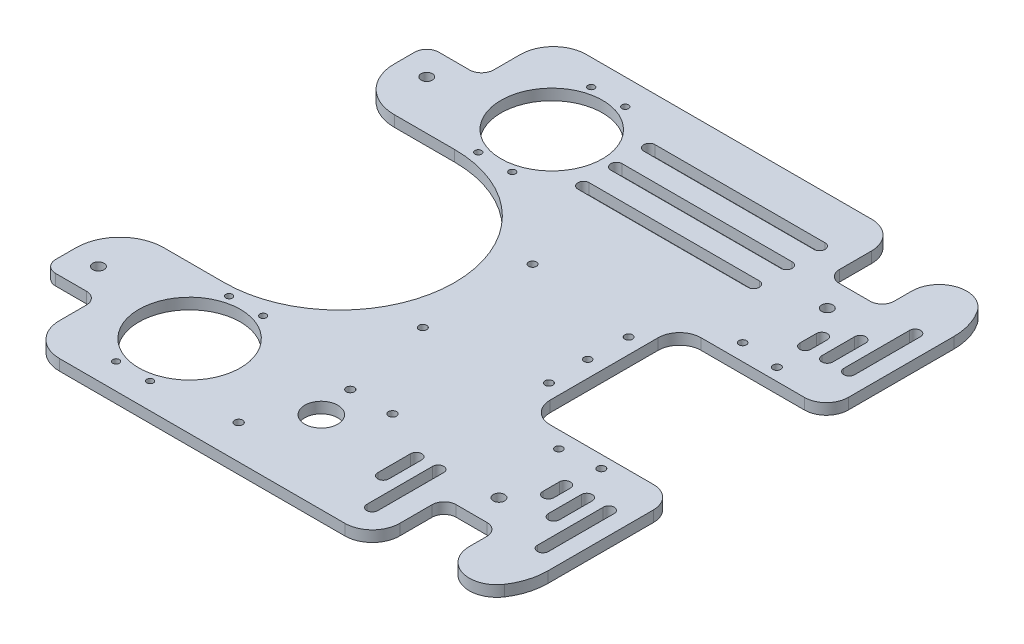
from build123d import *

# Parameters (mm, degrees)
SKETCH1_W           = 406.4
SKETCH1_H           = 304.8
BOSS_EXTRUDE1_DEPTH = 6.35
SKETCH2_R           = 29.36875
SKETCH2_R_2         = 2.2479
SKETCH2_R_3         = 1.89865
CUT_EXTRUDE1_DEPTH  = 255.079362602
FILLET1_R           = 34.925
CUT_EXTRUDE2_DEPTH  = 255.079362602
FILLET3_R           = 15.875
SKETCH7_R           = 3.2639
SKETCH7_R_2         = 2.159
CUT_EXTRUDE3_DEPTH  = 255.079362602
SKETCH8_R           = 3.2639
CUT_EXTRUDE5_DEPTH  = 255.079362602
CUT_EXTRUDE6_DEPTH  = 255.079362602
SKETCH10_W          = 44.1833
SKETCH10_H          = 6.35
BOSS_EXTRUDE2_DEPTH = 6.985
FILLET4_R           = 6.985
FILLET5_R           = 19.05
FILLET6_R           = 25.4
SKETCH12_R          = 2.2479
CUT_EXTRUDE8_DEPTH  = 255.079362602
SKETCH13_R          = 9.525
SKETCH13_R_2        = 2.325
CUT_EXTRUDE9_DEPTH  = 255.079362602
SKETCH15_W          = 49.318333333
SKETCH15_H          = 87.3125
CUT_EXTRUDE10_DEPTH = 255.079362602
FILLET7_R           = 12.7
CUT_EXTRUDE11_DEPTH = 255.079362602


with BuildPart() as part:
    # Sketch1 → Boss-Extrude1 (new body)
    with BuildSketch(Plane(origin=(0, 0, 0), x_dir=(1, 0, 0), z_dir=(0, 1, 0))):
        Rectangle(SKETCH1_W, SKETCH1_H)
    extrude(amount=BOSS_EXTRUDE1_DEPTH)

    # Sketch2 → Cut-Extrude1 (cut, through all)
    with BuildSketch(Plane.XZ):
        with Locations(Location((-16.8275, 104.775, 0), (0, 0, 270))):
            Circle(SKETCH2_R)
        with Locations(Location((167.428333333, -50.8, 0), (0, 0, 270))):
            Circle(SKETCH2_R_2)
        with Locations(Location((167.428333333, 50.8, 0), (0, 0, 270))):
            Circle(SKETCH2_R_2)
        with Locations(Location((45.085, -31.75, 0), (0, 0, 270))):
            Circle(SKETCH2_R_2)
        with Locations(Location((45.085, 31.75, 0), (0, 0, 270))):
            Circle(SKETCH2_R_2)
        with Locations(Location((-26.67, 137.4648, 0), (0, 0, 270))):
            Circle(SKETCH2_R_3)
        with Locations(Location((-6.985, 137.4648, 0), (0, 0, 270))):
            Circle(SKETCH2_R_3)
        with Locations(Location((-26.67, 72.0852, 0), (0, 0, 270))):
            Circle(SKETCH2_R_3)
        with Locations(Location((-6.985, 72.0852, 0), (0, 0, 270))):
            Circle(SKETCH2_R_3)
        with BuildLine():
            Line((170.786985294, 32.497058824), (169.990122549, 33.991176471))
            ThreePointArc((169.990122549, 33.991176471), (163.274429802, 41.054605225), (153.881666667, 43.65625))
            Line((153.881666667, 43.65625), (130.683, 43.65625))
            ThreePointArc((130.683, 43.65625), (121.904799642, 40.020200358), (118.26875, 31.242))
            Line((118.26875, 31.242), (118.26875, -31.242))
            ThreePointArc((118.26875, -31.242), (121.904799642, -40.020200358), (130.683, -43.65625))
            Line((130.683, -43.65625), (153.881666667, -43.65625))
            ThreePointArc((153.881666667, -43.65625), (163.274429802, -41.054605225), (169.990122549, -33.991176471))
            Line((169.990122549, -33.991176471), (170.786985294, -32.497058824))
            ThreePointArc((170.786985294, -32.497058824), (178.91125, 0), (170.786985294, 32.497058824))
        make_face()
        with BuildLine():
            Line((-73.025, 66.675), (-34.925, 66.675))
            ThreePointArc((-34.925, 66.675), (31.75, 0), (-34.925, -66.675))
            Line((-34.925, -66.675), (-73.025, -66.675))
            ThreePointArc((-73.025, -66.675), (-139.7, 0), (-73.025, 66.675))
        make_face()
    cut_extrude1 = extrude(amount=-CUT_EXTRUDE1_DEPTH, mode=Mode.SUBTRACT)

    # Fillet1
    fillet1_edges = [part.edges().sort_by_distance(p)[0] for p in [
        (203.2, 3.175, 152.4),
        (-203.2, 3.175, 152.4),
        (-203.2, 3.175, -152.4),
        (203.2, 3.175, -152.4),
    ]]
    fillet(fillet1_edges, radius=FILLET1_R)

    # Sketch5 → Cut-Extrude2 (cut, through all)
    with BuildSketch(Plane(origin=(0, 6.35, 0), x_dir=(1, 0, 0), z_dir=(0, 1, 0))):
        with BuildLine():
            Line((136.525, 117.8433), (136.525, 152.4))
            Line((136.525, 152.4), (168.275, 152.4))
            Line((168.275, 152.4), (168.275, 117.8433))
            ThreePointArc((168.275, 117.8433), (166.229140867, 112.904159133), (161.29, 110.8583))
            Line((161.29, 110.8583), (143.51, 110.8583))
            ThreePointArc((143.51, 110.8583), (138.570859133, 112.904159133), (136.525, 117.8433))
        make_face()
        with BuildLine():
            Line((143.51, -110.8583), (161.29, -110.8583))
            ThreePointArc((161.29, -110.8583), (166.229140867, -112.904159133), (168.275, -117.8433))
            Line((168.275, -117.8433), (168.275, -152.4))
            Line((168.275, -152.4), (136.525, -152.4))
            Line((136.525, -152.4), (136.525, -117.8433))
            ThreePointArc((136.525, -117.8433), (138.570859133, -112.904159133), (143.51, -110.8583))
        make_face()
        with BuildLine():
            Line((-95.25, 152.4), (-63.5, 152.4))
            Line((-63.5, 152.4), (-63.5, 117.8433))
            ThreePointArc((-63.5, 117.8433), (-65.545859133, 112.904159133), (-70.485, 110.8583))
            Line((-70.485, 110.8583), (-88.265, 110.8583))
            ThreePointArc((-88.265, 110.8583), (-93.204140867, 112.904159133), (-95.25, 117.8433))
            Line((-95.25, 117.8433), (-95.25, 152.4))
        make_face()
        with BuildLine():
            Line((-88.265, -110.8583), (-70.485, -110.8583))
            ThreePointArc((-70.485, -110.8583), (-65.545859133, -112.904159133), (-63.5, -117.8433))
            Line((-63.5, -117.8433), (-63.5, -152.4))
            Line((-63.5, -152.4), (-95.25, -152.4))
            Line((-95.25, -152.4), (-95.25, -117.8433))
            ThreePointArc((-95.25, -117.8433), (-93.204140867, -112.904159133), (-88.265, -110.8583))
        make_face()
    extrude(amount=-CUT_EXTRUDE2_DEPTH, mode=Mode.SUBTRACT)

    # Fillet3
    fillet3_edges = [part.edges().sort_by_distance(p)[0] for p in [
        (168.275, 3.175, 152.4),
        (168.275, 3.175, -152.4),
        (-95.25, 3.175, -152.4),
        (-95.25, 3.175, 152.4),
        (136.525, 3.175, -152.4),
        (136.525, 3.175, 152.4),
    ]]
    fillet(fillet3_edges, radius=FILLET3_R)

    # Sketch7 → Cut-Extrude3 (cut, through all)
    with BuildSketch(Plane(origin=(0, 6.35, 0), x_dir=(1, 0, 0), z_dir=(0, 1, 0))):
        with Locations(Location((152.4, 94.9833, 0), (0, 0, 270))):
            Circle(SKETCH7_R)
        with Locations(Location((152.4, -94.9833, 0), (0, 0, 270))):
            Circle(SKETCH7_R)
        with Locations(Location((145.25625, 53.18125, 0), (0, 0, 270))):
            Circle(SKETCH7_R_2)
        with Locations(Location((108.74375, 0, 0), (0, 0, 270))):
            Circle(SKETCH7_R_2)
        with Locations(Location((145.25625, -53.18125, 0), (0, 0, 270))):
            Circle(SKETCH7_R_2)
        with BuildLine():
            Line((119.0625, 127.0889), (20.6375, 127.0889))
            ThreePointArc((20.6375, 127.0889), (17.3736, 123.825), (20.6375, 120.5611))
            Line((20.6375, 120.5611), (119.0625, 120.5611))
            ThreePointArc((119.0625, 120.5611), (122.3264, 123.825), (119.0625, 127.0889))
        make_face()
        with BuildLine():
            Line((119.0625, 88.9889), (20.6375, 88.9889))
            ThreePointArc((20.6375, 88.9889), (17.3736, 85.725), (20.6375, 82.4611))
            Line((20.6375, 82.4611), (119.0625, 82.4611))
            ThreePointArc((119.0625, 82.4611), (122.3264, 85.725), (119.0625, 88.9889))
        make_face()
        with BuildLine():
            Line((119.0625, 108.0389), (20.6375, 108.0389))
            ThreePointArc((20.6375, 108.0389), (17.3736, 104.775), (20.6375, 101.5111))
            Line((20.6375, 101.5111), (119.0625, 101.5111))
            ThreePointArc((119.0625, 101.5111), (122.3264, 104.775), (119.0625, 108.0389))
        make_face()
        with BuildLine():
            Line((193.680475862, 107.6833), (193.680475862, 69.5833))
            ThreePointArc((193.680475862, 69.5833), (190.5, 66.402824138), (187.319524138, 69.5833))
            Line((187.319524138, 69.5833), (187.319524138, 107.6833))
            ThreePointArc((187.319524138, 107.6833), (190.5, 110.863775862), (193.680475862, 107.6833))
        make_face()
        with BuildLine():
            Line((174.619524138, 69.5833), (174.619524138, 88.6333))
            ThreePointArc((174.619524138, 88.6333), (177.8, 91.813775862), (180.980475862, 88.6333))
            Line((180.980475862, 88.6333), (180.980475862, 69.5833))
            ThreePointArc((180.980475862, 69.5833), (177.8, 66.402824138), (174.619524138, 69.5833))
        make_face()
        with BuildLine():
            Line((168.280475862, 79.1083), (168.280475862, 69.5833))
            ThreePointArc((168.280475862, 69.5833), (165.1, 66.402824138), (161.919524138, 69.5833))
            Line((161.919524138, 69.5833), (161.919524138, 79.1083))
            ThreePointArc((161.919524138, 79.1083), (165.1, 82.288775862), (168.280475862, 79.1083))
        make_face()
        with BuildLine():
            Line((193.680475862, -107.6833), (193.680475862, -69.5833))
            ThreePointArc((193.680475862, -69.5833), (190.5, -66.402824138), (187.319524138, -69.5833))
            Line((187.319524138, -69.5833), (187.319524138, -107.6833))
            ThreePointArc((187.319524138, -107.6833), (190.5, -110.863775862), (193.680475862, -107.6833))
        make_face()
        with BuildLine():
            Line((174.619524138, -69.5833), (174.619524138, -88.6333))
            ThreePointArc((174.619524138, -88.6333), (177.8, -91.813775862), (180.980475862, -88.6333))
            Line((180.980475862, -88.6333), (180.980475862, -69.5833))
            ThreePointArc((180.980475862, -69.5833), (177.8, -66.402824138), (174.619524138, -69.5833))
        make_face()
        with BuildLine():
            Line((168.280475862, -79.1083), (168.280475862, -69.5833))
            ThreePointArc((168.280475862, -69.5833), (165.1, -66.402824138), (161.919524138, -69.5833))
            Line((161.919524138, -69.5833), (161.919524138, -79.1083))
            ThreePointArc((161.919524138, -79.1083), (165.1, -82.288775862), (168.280475862, -79.1083))
        make_face()
    extrude(amount=-CUT_EXTRUDE3_DEPTH, mode=Mode.SUBTRACT)

    # Sketch8 → Cut-Extrude5 (cut, through all)
    with BuildSketch(Plane(origin=(0, 6.35, 0), x_dir=(1, 0, 0), z_dir=(0, 1, 0))):
        with Locations(Location((-79.375, 94.9833, 0), (0, 0, 270))):
            Circle(SKETCH8_R)
        with Locations(Location((-79.375, -94.9833, 0), (0, 0, 90))):
            Circle(SKETCH8_R)
        with BuildLine():
            Line((-95.25, 136.525), (-95.25, 117.8433))
            ThreePointArc((-95.25, 117.8433), (-93.204140867, 112.904159133), (-88.265, 110.8583))
            ThreePointArc((-88.265, 110.8583), (-110.35665, 88.76665), (-88.265, 66.675))
            Line((-88.265, 66.675), (-73.025, 66.675))
            ThreePointArc((-73.025, 66.675), (-139.7, 0), (-73.025, -66.675))
            Line((-73.025, -66.675), (-88.265, -66.675))
            ThreePointArc((-88.265, -66.675), (-110.35665, -88.76665), (-88.265, -110.8583))
            ThreePointArc((-88.265, -110.8583), (-93.204140867, -112.904159133), (-95.25, -117.8433))
            Line((-95.25, -117.8433), (-95.25, -136.525))
            ThreePointArc((-95.25, -136.525), (-99.899679849, -147.750320151), (-111.125, -152.4))
            Line((-111.125, -152.4), (-168.275, -152.4))
            ThreePointArc((-168.275, -152.4), (-192.970704333, -142.170704333), (-203.2, -117.475))
            Line((-203.2, -117.475), (-203.2, 117.475))
            ThreePointArc((-203.2, 117.475), (-192.970704333, 142.170704333), (-168.275, 152.4))
            Line((-168.275, 152.4), (-111.125, 152.4))
            ThreePointArc((-111.125, 152.4), (-99.899679849, 147.750320151), (-95.25, 136.525))
        make_face()
    extrude(amount=-CUT_EXTRUDE5_DEPTH, mode=Mode.SUBTRACT)

    # Sketch9 → Cut-Extrude6 (cut, through all)
    with BuildSketch(Plane(origin=(0, 6.35, 0), x_dir=(1, 0, 0), z_dir=(0, 1, 0))):
        with BuildLine():
            Line((-88.265, 110.8583), (-88.265, 66.675))
            ThreePointArc((-88.265, 66.675), (-110.35665, 88.76665), (-88.265, 110.8583))
        make_face()
        with BuildLine():
            Line((-88.265, -110.8583), (-88.265, -66.675))
            ThreePointArc((-88.265, -66.675), (-110.35665, -88.76665), (-88.265, -110.8583))
        make_face()
    extrude(amount=-CUT_EXTRUDE6_DEPTH, mode=Mode.SUBTRACT)

    # Sketch10 → Boss-Extrude2 (add)
    with BuildSketch(Plane.ZY.offset(88.265)):
        with Locations((-88.76665, 3.175)):
            Rectangle(SKETCH10_W, SKETCH10_H)
        with Locations((88.76665, 3.175)):
            Rectangle(SKETCH10_W, SKETCH10_H)
    extrude(amount=BOSS_EXTRUDE2_DEPTH)

    # Fillet4
    fillet4_edges = [part.edges().sort_by_distance(p)[0] for p in [
        (-95.25, 3.175, -110.8583),
        (-95.25, 3.175, 110.8583),
    ]]
    fillet(fillet4_edges, radius=FILLET4_R)

    # Mirror1: Cut-Extrude1 across plane
    add(cut_extrude1.mirror(Plane.XY), mode=Mode.SUBTRACT)

    # Fillet5
    fillet5_edges = [part.edges().sort_by_distance(p)[0] for p in [
        (-63.5, 3.175, -152.4),
        (-63.5, 3.175, 152.4),
    ]]
    fillet(fillet5_edges, radius=FILLET5_R)

    # Fillet6
    fillet6_edges = [part.edges().sort_by_distance(p)[0] for p in [
        (-95.25, 3.175, -66.675),
        (-95.25, 3.175, 66.675),
    ]]
    fillet(fillet6_edges, radius=FILLET6_R)

    # Sketch12 → Cut-Extrude8 (cut, through all)
    with BuildSketch(Plane(origin=(0, 6.35, 0), x_dir=(1, 0, 0), z_dir=(0, 1, 0))):
        with Locations(Location((109.37875, 23.0632, 0), (0, 0, 270))):
            Circle(SKETCH12_R)
        with Locations(Location((109.37875, -23.0632, 0), (0, 0, 90))):
            Circle(SKETCH12_R)
    extrude(amount=-CUT_EXTRUDE8_DEPTH, mode=Mode.SUBTRACT)

    # Sketch13 → Cut-Extrude9 (cut, through all)
    with BuildSketch(Plane(origin=(0, 6.35, 0), x_dir=(1, 0, 0), z_dir=(0, 1, 0))):
        with Locations(Location((59.3725, -104.775, 0), (0, 0, 270))):
            Circle(SKETCH13_R)
        with Locations(Location((39.3691, -132.587319928, 0), (0, 0, 90))):
            Circle(SKETCH13_R_2)
        with Locations(Location((55.154204875, -83.781, 0), (0, 0, 90))):
            Circle(SKETCH13_R_2)
        with Locations(Location((79.600806672, -83.781, 0), (0, 0, 90))):
            Circle(SKETCH13_R_2)
    extrude(amount=-CUT_EXTRUDE9_DEPTH, mode=Mode.SUBTRACT)

    # Sketch15 → Cut-Extrude10 (cut, through all)
    with BuildSketch(Plane(origin=(0, 6.35, 0), x_dir=(1, 0, 0), z_dir=(0, 1, 0))):
        with Locations((178.540833334, 0)):
            Rectangle(SKETCH15_W, SKETCH15_H)
    extrude(amount=-CUT_EXTRUDE10_DEPTH, mode=Mode.SUBTRACT)

    # Fillet7
    fillet7_edges = [part.edges().sort_by_distance(p)[0] for p in [
        (203.2, 3.175, -43.65625),
        (203.2, 3.175, 43.65625),
    ]]
    fillet(fillet7_edges, radius=FILLET7_R)

    # Sketch16 → Cut-Extrude11 (cut, through all)
    with BuildSketch(Plane(origin=(0, 6.35, 0), x_dir=(1, 0, 0), z_dir=(0, 1, 0))):
        with BuildLine():
            Line((104.769524138, -98.425), (104.769524138, -117.475))
            ThreePointArc((104.769524138, -117.475), (107.95, -120.655475862), (111.130475862, -117.475))
            Line((111.130475862, -117.475), (111.130475862, -98.425))
            ThreePointArc((111.130475862, -98.425), (107.95, -95.244524138), (104.769524138, -98.425))
        make_face()
        with BuildLine():
            Line((117.469524138, -136.525), (117.469524138, -98.425))
            ThreePointArc((117.469524138, -98.425), (120.65, -95.244524138), (123.830475862, -98.425))
            Line((123.830475862, -98.425), (123.830475862, -136.525))
            ThreePointArc((123.830475862, -136.525), (120.65, -139.705475862), (117.469524138, -136.525))
        make_face()
    extrude(amount=-CUT_EXTRUDE11_DEPTH, mode=Mode.SUBTRACT)


solid = part.part
